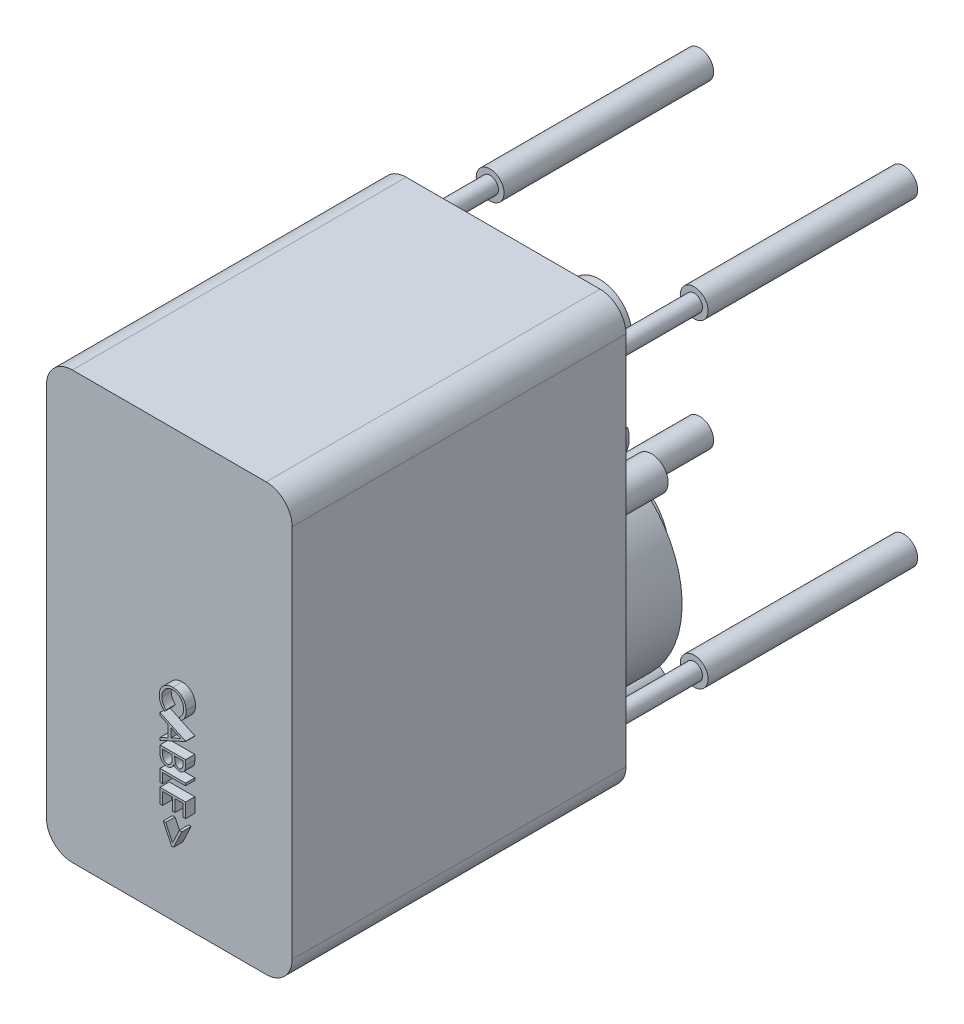
from build123d import *

# Parameters (mm, degrees)
BOSS_EXTRUDE1_DEPTH      = 10.16
SKETCH2_R                = 6.35
BOSS_EXTRUDE2_DEPTH      = 1.778
SKETCH3_R                = 2.286
BOSS_EXTRUDE3_DEPTH      = 1.27
BOSS_EXTRUDE4_DEPTH      = 3.302
BOSS_EXTRUDE5_DEPTH      = 11.43
SKETCH6_R                = 1.143
BOSS_EXTRUDE6_DEPTH      = 15.494
BOSS_EXTRUDE6_2_DEPTH    = 15.494
BOSS_EXTRUDE6_3_DEPTH    = 15.494
BOSS_EXTRUDE6_4_DEPTH    = 15.494
SKETCH7_R                = 7.239
BOSS_EXTRUDE7_DEPTH      = 5.334
BOSS_EXTRUDE8_DEPTH      = 45.72
BOSS_EXTRUDE9_DEPTH      = 25.4
BOSS_EXTRUDE9_DEPTH_BACK = 3.302
SKETCH9_R                = 1.905
BOSS_EXTRUDE10_DEPTH     = 1.27


with BuildPart() as part:
    # Sketch1 → Boss-Extrude1 (new body)
    with BuildSketch(Plane.XY):
        with BuildLine():
            ThreePointArc((10.064128852, -22.930567504), (14.351, -12.7), (10.064128852, -2.469432496))
            ThreePointArc((10.064128852, -2.469432496), (10.236847552, 1.339105214), (6.663505747, 0.010188518))
            ThreePointArc((6.663505747, 0.010188518), (0, 1.651), (-6.663505747, 0.010188518))
            ThreePointArc((-6.663505747, 0.010188518), (-10.236847552, 1.339105214), (-10.064128852, -2.469432496))
            ThreePointArc((-10.064128852, -2.469432496), (-14.351, -12.7), (-10.064128852, -22.930567504))
            ThreePointArc((-10.064128852, -22.930567504), (-10.236847552, -26.739105214), (-6.663505747, -25.410188518))
            ThreePointArc((-6.663505747, -25.410188518), (0, -27.051), (6.663505747, -25.410188518))
            ThreePointArc((6.663505747, -25.410188518), (10.236847552, -26.739105214), (10.064128852, -22.930567504))
        make_face()
    extrude(amount=-BOSS_EXTRUDE1_DEPTH)

    # Sketch3 → Boss-Extrude3 (add)
    with BuildSketch(Plane(origin=(0, 0, -10.16), x_dir=(-1, 0, 0), z_dir=(0, 0, -1))):
        with Locations((-8.89, -0.508)):
            Circle(SKETCH3_R)
        with Locations((8.89, -24.892)):
            Circle(SKETCH3_R)
        with Locations((-8.89, -24.892)):
            Circle(SKETCH3_R)
        with Locations((8.89, -0.508)):
            Circle(SKETCH3_R)
    extrude(amount=BOSS_EXTRUDE3_DEPTH)

    # Sketch4 → Boss-Extrude4 (add)
    with BuildSketch(Plane(origin=(0, 0, -10.16), x_dir=(-1, 0, 0), z_dir=(0, 0, -1))):
        with BuildLine():
            ThreePointArc((-3.62043784, 1.186815), (0, -3.81), (3.62043784, 1.186815))
            ThreePointArc((3.62043784, 1.186815), (0, 1.651), (-3.62043784, 1.186815))
        make_face()
    extrude(amount=BOSS_EXTRUDE4_DEPTH)

    # Sketch7 → Boss-Extrude7 (add)
    with BuildSketch(Plane(origin=(0, 0, -10.16), x_dir=(-1, 0, 0), z_dir=(0, 0, -1))):
        with Locations((0, -12.7)):
            Circle(SKETCH7_R)
    extrude(amount=BOSS_EXTRUDE7_DEPTH)



with BuildPart() as body_2:
    # Sketch2 → Boss-Extrude2 (new body)
    with BuildSketch(Plane.XY):
        with Locations((0, 14.605)):
            Circle(SKETCH2_R)
    extrude(amount=-BOSS_EXTRUDE2_DEPTH)

    # Sketch5 → Boss-Extrude5 (add)
    with BuildSketch(Plane(origin=(0, 0, -1.778), x_dir=(-1, 0, 0), z_dir=(0, 0, -1))):
        with BuildLine():
            ThreePointArc((2e-08, 8.255), (3.14308965, 9.556910365), (4.445, 12.7))
            ThreePointArc((4.445, 12.7), (-3.14308965, 15.843089635), (2e-08, 8.255))
        make_face()
    extrude(amount=BOSS_EXTRUDE5_DEPTH)


with BuildPart() as body_3:
    # Sketch6 → Boss-Extrude6 (new body)
    with BuildSketch(Plane.XY):
        with Locations((13.97, 21.844)):
            Circle(SKETCH6_R)
    extrude(amount=-BOSS_EXTRUDE6_DEPTH)


with BuildPart() as body_4:
    # Sketch6 → Boss-Extrude6 2 (new body)
    with BuildSketch(Plane.XY):
        with Locations((-13.97, 21.844)):
            Circle(SKETCH6_R)
    extrude(amount=-BOSS_EXTRUDE6_2_DEPTH)


with BuildPart() as body_5:
    # Sketch6 → Boss-Extrude6 3 (new body)
    with BuildSketch(Plane.XY):
        with Locations((13.97, -21.844)):
            Circle(SKETCH6_R)
    extrude(amount=-BOSS_EXTRUDE6_3_DEPTH)


with BuildPart() as body_6:
    # Sketch6 → Boss-Extrude6 4 (new body)
    with BuildSketch(Plane.XY):
        with Locations((-13.97, -21.844)):
            Circle(SKETCH6_R)
    extrude(amount=-BOSS_EXTRUDE6_4_DEPTH)


with BuildPart() as part_1:
    add(part.part)

    add(body_2.part)  # Boss-Extrude8 merges body 2

    add(body_3.part)  # Boss-Extrude8 merges body 3

    add(body_4.part)  # Boss-Extrude8 merges body 4

    add(body_5.part)  # Boss-Extrude8 merges body 5

    add(body_6.part)  # Boss-Extrude8 merges body 6
    # Sketch8 → Boss-Extrude8 (add)
    with BuildSketch(Plane.XY):
        with BuildLine():
            Line((-13.2715, 29.21), (13.2715, 29.21))
            ThreePointArc((13.2715, 29.21), (15.785971714, 28.168471714), (16.8275, 25.654))
            Line((16.8275, 25.654), (16.8275, -25.654))
            ThreePointArc((16.8275, -25.654), (15.785971714, -28.168471714), (13.2715, -29.21))
            Line((13.2715, -29.21), (-13.2715, -29.21))
            ThreePointArc((-13.2715, -29.21), (-15.785971714, -28.168471714), (-16.8275, -25.654))
            Line((-16.8275, -25.654), (-16.8275, 25.654))
            ThreePointArc((-16.8275, 25.654), (-15.785971714, 28.168471714), (-13.2715, 29.21))
        make_face()
    extrude(amount=BOSS_EXTRUDE8_DEPTH)

    # Sketch9 → Boss-Extrude9 (add, two sides: drawn at the far end of the back side and taken through both)
    with BuildSketch(Plane(origin=(0, 0, -15.494), x_dir=(-1, 0, 0), z_dir=(0, 0, -1)).offset(-BOSS_EXTRUDE9_DEPTH_BACK)):
        with Locations((-13.97, 21.844)):
            Circle(SKETCH9_R)
        with Locations((13.97, 21.844)):
            Circle(SKETCH9_R)
        with Locations((13.97, -21.844)):
            Circle(SKETCH9_R)
        with Locations((-13.97, -21.844)):
            Circle(SKETCH9_R)
    extrude(amount=BOSS_EXTRUDE9_DEPTH + BOSS_EXTRUDE9_DEPTH_BACK)

    # Sketch10 → Boss-Extrude10 (add)
    # profile 1 of 6: a face of its own
    with BuildSketch(Plane.XY.offset(45.72)):
        with BuildLine():
            Line((2.857772436, -3.679487179), (2.647435897, -3.404647436))
            add(Edge.make_bspline(
                [(2.647435897, -3.404647436), (2.670801867, -3.385041548), (2.717218783, -3.346094101), (2.782398327, -3.283434898), (2.843463589, -3.218133255), (2.900705469, -3.150214134), (2.952122234, -3.078455015), (3.000393337, -3.004594216), (3.043661075, -2.927396171), (3.096124061, -2.820644436), (3.150870216, -2.680996588), (3.196773448, -2.505201749), (3.225994623, -2.32169065), (3.229159465, -2.196493051), (3.230769231, -2.1328125)],
                knots=[0, 0, 0, 0, 0.757959112, 1.505699292, 2.245454638, 2.979532153, 3.711538275, 4.438200793, 5.171680507, 5.909471876, 7.393775596, 8.890124382, 10.418191784, 12, 12, 12, 12], degree=3))
            add(Edge.make_bspline(
                [(3.230769231, -2.1328125), (3.230363445, -2.097729627), (3.229555641, -2.027889483), (3.218973416, -1.924234716), (3.20392868, -1.822319184), (3.1821483, -1.722521872), (3.153792222, -1.625040935), (3.120538112, -1.529134135), (3.079156746, -1.435930999), (3.033456552, -1.34430985), (2.981823731, -1.256534692), (2.925523467, -1.173466714), (2.865108338, -1.095485416), (2.800734294, -1.02237471), (2.731601295, -0.954936411), (2.658522608, -0.892089722), (2.580618642, -0.834967287), (2.499350418, -0.782165421), (2.41459849, -0.735181205), (2.326896016, -0.694608059), (2.236578315, -0.6598335), (2.143460367, -0.632062149), (2.047908611, -0.610157149), (1.949720267, -0.59502418), (1.849085923, -0.584537152), (1.780876701, -0.583736779), (1.746494391, -0.583333333)],
                knots=[0, 0, 0, 0, 1.055000685, 2.100209969, 3.131349012, 4.153242145, 5.170189196, 6.184191144, 7.204341339, 8.235672124, 9.263040994, 10.265373269, 11.252624173, 12.22887325, 13.193405896, 14.155809299, 15.126090485, 16.097288279, 17.069732292, 18.038585918, 19.002221264, 19.978698174, 20.959418239, 21.948869816, 22.966084182, 24, 24, 24, 24], degree=3))
            add(Edge.make_bspline(
                [(1.746494391, -0.583333333), (1.694763071, -0.584595152), (1.593195486, -0.587072567), (1.444424876, -0.609120901), (1.301904202, -0.642625992), (1.16652436, -0.692841569), (1.036616002, -0.75476062), (0.914377148, -0.833001231), (0.797960584, -0.923617768), (0.690117636, -1.027892188), (0.591603911, -1.142298004), (0.504853329, -1.265045915), (0.432538447, -1.395830203), (0.3723625, -1.533206833), (0.326105772, -1.678232947), (0.293541649, -1.83064775), (0.272299468, -1.990119745), (0.27026578, -2.099089145), (0.269230769, -2.154547276)],
                knots=[0, 0, 0, 0, 1.029171465, 2.020641659, 2.987623507, 3.938342917, 4.889210282, 5.84687017, 6.821220943, 7.821438502, 8.827599549, 9.822697543, 10.807740252, 11.797342354, 12.80366471, 13.83203677, 14.896651826, 16, 16, 16, 16], degree=3))
            add(Edge.make_bspline(
                [(0.269230769, -2.154547276), (0.270919549, -2.215649965), (0.274243472, -2.335914674), (0.302402721, -2.5122827), (0.348060638, -2.681118466), (0.411958561, -2.842431052), (0.495023849, -2.995765698), (0.595721726, -3.141362359), (0.715010059, -3.279343929), (0.806093187, -3.362315211), (0.852564103, -3.404647436)],
                knots=[0, 0, 0, 0, 1.028121516, 2.023589091, 2.998037872, 3.967518031, 4.937445131, 5.927275754, 6.942489185, 8, 8, 8, 8], degree=3))
            Line((0.852564103, -3.404647436), (0.644330929, -3.679487179))
            add(Edge.make_bspline(
                [(0.644330929, -3.679487179), (0.615792429, -3.657369099), (0.558852125, -3.613238882), (0.478581139, -3.54178043), (0.403074401, -3.466504759), (0.332956835, -3.386842997), (0.266764666, -3.303747898), (0.206716932, -3.215755784), (0.150984484, -3.12438645), (0.100628049, -3.02910793), (0.05547798, -2.930233036), (0.017361042, -2.827864665), (-0.015946051, -2.722870088), (-0.04316627, -2.615196429), (-0.064445988, -2.50448398), (-0.078663293, -2.391112597), (-0.088405847, -2.274842967), (-0.089293675, -2.196401513), (-0.08974359, -2.156650641)],
                knots=[0, 0, 0, 0, 0.986756325, 1.968786143, 2.935506311, 3.899499537, 4.868307269, 5.8376204, 6.809456583, 7.792545619, 8.781780509, 9.778496008, 10.776623214, 11.79151764, 12.812666265, 13.856269958, 14.913646641, 16, 16, 16, 16], degree=3))
            add(Edge.make_bspline(
                [(-0.08974359, -2.156650641), (-0.089481597, -2.119006974), (-0.088963539, -2.044571284), (-0.080571372, -1.934672532), (-0.069121635, -1.827682951), (-0.051881504, -1.723908326), (-0.031537164, -1.622782351), (-0.004265907, -1.525221766), (0.026283259, -1.430266556), (0.062188246, -1.338298215), (0.102704429, -1.249238515), (0.148495987, -1.163374704), (0.199177852, -1.080746271), (0.253632863, -1.000540851), (0.313610164, -0.923943267), (0.378276799, -0.850289742), (0.44741481, -0.779167265), (0.497269663, -0.73516458), (0.522335737, -0.713040865)],
                knots=[0, 0, 0, 0, 1.114604814, 2.203992996, 3.262667896, 4.300477797, 5.318619304, 6.316056647, 7.298880507, 8.271930387, 9.238335007, 10.195173496, 11.151986948, 12.108099108, 13.064862484, 14.031167946, 15.010108607, 16, 16, 16, 16], degree=3))
            add(Edge.make_bspline(
                [(0.522335737, -0.713040865), (0.565876926, -0.677605222), (0.652433637, -0.607161745), (0.792719618, -0.517036062), (0.939187827, -0.439888506), (1.092607755, -0.377512586), (1.252635143, -0.328749852), (1.419350657, -0.294968657), (1.592598599, -0.273017053), (1.710435388, -0.270506764), (1.770332532, -0.269230769)],
                knots=[0, 0, 0, 0, 0.994628077, 1.977248131, 2.950237994, 3.925870899, 4.908910175, 5.911660606, 6.938484602, 8, 8, 8, 8], degree=3))
            add(Edge.make_bspline(
                [(1.770332532, -0.269230769), (1.833285352, -0.270792919), (1.957141094, -0.27386635), (2.138952641, -0.299762866), (2.312890308, -0.341927395), (2.479623367, -0.399988234), (2.638197835, -0.476586004), (2.789283438, -0.569313798), (2.93275681, -0.679077345), (3.066783632, -0.804498118), (3.18931972, -0.9420727), (3.297126777, -1.089389619), (3.386844068, -1.246172066), (3.461840291, -1.410689784), (3.519484737, -1.584175502), (3.559837929, -1.766258861), (3.584955044, -1.956597778), (3.588130252, -2.086460203), (3.58974359, -2.15244391)],
                knots=[0, 0, 0, 0, 1.032901378, 2.032168977, 3.007206631, 3.966850309, 4.924221947, 5.891988639, 6.871730993, 7.884084801, 8.900290346, 9.89161143, 10.874607481, 11.860025555, 12.854717796, 13.869097222, 14.917278314, 16, 16, 16, 16], degree=3))
            add(Edge.make_bspline(
                [(3.58974359, -2.15244391), (3.589261812, -2.192658461), (3.588308181, -2.272259114), (3.578996816, -2.390010625), (3.563502411, -2.50465715), (3.542274027, -2.616475949), (3.516255146, -2.725872498), (3.482194419, -2.83172447), (3.442641565, -2.934608269), (3.39824916, -3.03460095), (3.347498469, -3.130614623), (3.292377899, -3.222631813), (3.231615083, -3.309542503), (3.167218841, -3.392981488), (3.096780331, -3.471070292), (3.022593437, -3.546039113), (2.942456775, -3.615298244), (2.886052222, -3.658051701), (2.857772436, -3.679487179)],
                knots=[0, 0, 0, 0, 1.096705196, 2.170817488, 3.219277236, 4.250701065, 5.274195539, 6.284202015, 7.28098643, 8.279664616, 9.266225751, 10.241373748, 11.203306326, 12.157093976, 13.114198862, 14.069774147, 15.032234603, 16, 16, 16, 16], degree=3))
        make_face()
    # profile 2 of 6: a face of its own
    with BuildSketch(Plane.XY.offset(45.72)):
        Polygon((3.5, -5.833333333), (0, -7.448717949), (0, -7.107271635), (1.121794872, -6.58984375), (1.121794872, -5.003205128), (0, -4.471053686), (0, -4.128205128), (3.5, -5.788461538), align=None)
        Polygon((2.817808494, -5.807391827), (1.480769231, -5.173577724), (1.480769231, -6.424379006), align=None, mode=Mode.SUBTRACT)
    # profile 3 of 6: a face of its own
    with BuildSketch(Plane.XY.offset(45.72)):
        with BuildLine():
            Line((3.5, -7.987179487), (3.5, -8.670072115))
            add(Edge.make_bspline(
                [(3.5, -8.670072115), (3.49982425, -8.703500594), (3.499483602, -8.768293304), (3.49420047, -8.862512746), (3.486996801, -8.950761556), (3.475566708, -9.033065329), (3.461774931, -9.109386031), (3.445073115, -9.179953668), (3.425046501, -9.244543841), (3.39320022, -9.321656577), (3.345877051, -9.409577238), (3.275948486, -9.504775631), (3.190416023, -9.58617987), (3.093933368, -9.656366187), (2.987797596, -9.712167307), (2.874538407, -9.752536604), (2.755616665, -9.778094479), (2.673973487, -9.780722914), (2.63271234, -9.782051282)],
                knots=[0, 0, 0, 0, 1.001505555, 1.941167018, 2.826882275, 3.653841531, 4.429895133, 5.150066043, 5.825578002, 6.45369114, 7.647487171, 8.808567382, 9.977351308, 11.170798116, 12.373658725, 13.556498008, 14.765093433, 16, 16, 16, 16], degree=3))
            add(Edge.make_bspline(
                [(2.63271234, -9.782051282), (2.594053235, -9.780979192), (2.518084448, -9.778872435), (2.407150679, -9.758040783), (2.301116128, -9.727025424), (2.201287981, -9.682000287), (2.108949247, -9.624084028), (2.02464869, -9.554388494), (1.950429264, -9.471406851), (1.909109541, -9.409135189), (1.888120994, -9.377504006)],
                knots=[0, 0, 0, 0, 1.044266239, 2.052081639, 3.041743201, 4.026043445, 5.00270663, 5.980942822, 6.97441044, 8, 8, 8, 8], degree=3))
            add(Edge.make_bspline(
                [(1.888120994, -9.377504006), (1.872867775, -9.417271093), (1.843684588, -9.49335538), (1.791808319, -9.598132695), (1.736021049, -9.688767398), (1.674776106, -9.76535925), (1.607935032, -9.829876034), (1.536836284, -9.887813444), (1.45797957, -9.936352004), (1.37361028, -9.978050718), (1.284320561, -10.010867169), (1.190518767, -10.034086961), (1.093253774, -10.048354394), (1.026957798, -10.050299901), (0.993489583, -10.051282051)],
                knots=[0, 0, 0, 0, 1.272302504, 2.434229863, 3.488457646, 4.447234501, 5.35599188, 6.26022912, 7.18267843, 8.11661068, 9.06895546, 10.019249207, 11.000057067, 12, 12, 12, 12], degree=3))
            add(Edge.make_bspline(
                [(0.993489583, -10.051282051), (0.959322905, -10.050304899), (0.892099008, -10.048382324), (0.793341106, -10.034206731), (0.698976329, -10.010181531), (0.60833373, -9.977169594), (0.521926377, -9.933840061), (0.438672091, -9.882245878), (0.36078871, -9.819449219), (0.286424081, -9.749453453), (0.219600708, -9.670175718), (0.160109352, -9.584653658), (0.110959363, -9.491657184), (0.070188246, -9.392628424), (0.038590839, -9.286909331), (0.016654453, -9.174891884), (0.001839273, -9.056551741), (0.000623494, -8.975341406), (0, -8.93369391)],
                knots=[0, 0, 0, 0, 0.978404568, 1.925038397, 2.85041836, 3.763147166, 4.682162379, 5.614488577, 6.562659439, 7.54271123, 8.535210642, 9.526693784, 10.520907202, 11.541451354, 12.589717429, 13.675358278, 14.807842563, 16, 16, 16, 16], degree=3))
            Line((0, -8.93369391), (0, -7.987179487))
            Line((0, -7.987179487), (3.5, -7.987179487))
        make_face()
        with BuildLine():
            Line((3.141025641, -8.301282051), (2.019230769, -8.301282051))
            Line((2.019230769, -8.301282051), (2.019230769, -8.512319712))
            add(Edge.make_bspline(
                [(2.019230769, -8.512319712), (2.019627364, -8.543168785), (2.020393667, -8.602775481), (2.022657945, -8.689324772), (2.028720383, -8.769462091), (2.035132411, -8.843463576), (2.045005621, -8.910833237), (2.057087658, -8.97179661), (2.069753809, -9.026901337), (2.091355012, -9.090420305), (2.122955643, -9.162449973), (2.173150423, -9.238748286), (2.231312009, -9.307103551), (2.299660574, -9.364179334), (2.374282065, -9.411276833), (2.455183134, -9.44270766), (2.539205431, -9.465001132), (2.597038901, -9.466956125), (2.626402244, -9.467948718)],
                knots=[0, 0, 0, 0, 1.156481963, 2.23455883, 3.244418989, 4.168404366, 5.01828131, 5.794834307, 6.498111525, 7.13526334, 8.307595709, 9.435046769, 10.546766856, 11.659452936, 12.760769924, 13.837671619, 14.902137667, 16, 16, 16, 16], degree=3))
            add(Edge.make_bspline(
                [(2.626402244, -9.467948718), (2.645837164, -9.46745228), (2.683960884, -9.466478463), (2.739322416, -9.457615573), (2.792056229, -9.444755433), (2.84094948, -9.424663971), (2.887391857, -9.40036924), (2.929320542, -9.368766205), (2.969032638, -9.333075662), (3.005070015, -9.291160594), (3.037359647, -9.243223955), (3.06577169, -9.188808998), (3.088183923, -9.12726598), (3.108288888, -9.059990319), (3.122239543, -8.985905328), (3.133904149, -8.905734918), (3.13983359, -8.81879898), (3.140619428, -8.758654053), (3.141025641, -8.727564103)],
                knots=[0, 0, 0, 0, 0.911752476, 1.788502045, 2.626783689, 3.45400582, 4.26402138, 5.080402872, 5.911472738, 6.767166405, 7.66795952, 8.620018292, 9.640966946, 10.73819047, 11.913090943, 13.176185384, 14.540321519, 16, 16, 16, 16], degree=3))
            Line((3.141025641, -8.727564103), (3.141025641, -8.301282051))
        make_face(mode=Mode.SUBTRACT)
        with BuildLine():
            Line((1.66025641, -8.301282051), (0.358974359, -8.301282051))
            Line((0.358974359, -8.301282051), (0.358974359, -8.748597756))
            add(Edge.make_bspline(
                [(0.358974359, -8.748597756), (0.359356766, -8.780616841), (0.360093805, -8.842329406), (0.362526199, -8.931428523), (0.367942779, -9.013786891), (0.376773248, -9.089451901), (0.385948875, -9.159089613), (0.398648387, -9.222008173), (0.413086196, -9.278304041), (0.43542939, -9.343572232), (0.470080688, -9.417115598), (0.522667742, -9.496314398), (0.584492161, -9.56743167), (0.656948104, -9.627131057), (0.735135085, -9.676428471), (0.81864416, -9.711003623), (0.904927716, -9.733234951), (0.963909533, -9.735861995), (0.993489583, -9.737179487)],
                knots=[0, 0, 0, 0, 1.159821618, 2.235403267, 3.228114831, 4.14795534, 4.994323282, 5.771256229, 6.471395042, 7.097801288, 8.267864287, 9.404187171, 10.531774336, 11.667624178, 12.792825787, 13.866573821, 14.930062559, 16, 16, 16, 16], degree=3))
            add(Edge.make_bspline(
                [(0.993489583, -9.737179487), (1.011985316, -9.736910196), (1.048678445, -9.736375957), (1.102559382, -9.728016016), (1.154984973, -9.716353352), (1.205162465, -9.699464814), (1.253908353, -9.678169735), (1.30037356, -9.651445218), (1.345669087, -9.620583465), (1.402867072, -9.572305486), (1.468791298, -9.502150596), (1.533326389, -9.402438104), (1.585374877, -9.28906742), (1.607474256, -9.206839697), (1.618890224, -9.164362981)],
                knots=[0, 0, 0, 0, 0.723503378, 1.435336582, 2.130201219, 2.824764462, 3.504949994, 4.209866579, 4.920640069, 5.648298893, 7.13757748, 8.670694625, 10.280166878, 12, 12, 12, 12], degree=3))
            add(Edge.make_bspline(
                [(1.618890224, -9.164362981), (1.622345541, -9.147333901), (1.629837379, -9.110411343), (1.637740616, -9.050203457), (1.644830077, -8.981237103), (1.64993647, -8.903807058), (1.655418093, -8.81760537), (1.657474037, -8.722659733), (1.659983424, -8.618903025), (1.660163087, -8.546910565), (1.66025641, -8.509515224)],
                knots=[0, 0, 0, 0, 0.634452549, 1.375623993, 2.216454381, 3.166361212, 4.209414599, 5.370755378, 6.634280627, 8, 8, 8, 8], degree=3))
            Line((1.66025641, -8.509515224), (1.66025641, -8.301282051))
        make_face(mode=Mode.SUBTRACT)
    # profile 4 of 6: a face of its own
    with BuildSketch(Plane.XY.offset(45.72)):
        Polygon((3.5, -10.769230769), (3.5, -11.083333333), (0.358974359, -11.083333333), (0.358974359, -12.429487179), (0, -12.429487179), (0, -10.769230769), align=None)
    # profile 5 of 6: a face of its own
    with BuildSketch(Plane.XY.offset(45.72)):
        Polygon((3.5, -13.012820513), (3.5, -14.987179487), (3.141025641, -14.987179487), (3.141025641, -13.326923077), (2.064102564, -13.326923077), (2.064102564, -14.987179487), (1.705128205, -14.987179487), (1.705128205, -13.326923077), (0.358974359, -13.326923077), (0.358974359, -14.987179487), (0, -14.987179487), (0, -13.012820513), align=None)
    # profile 6 of 6: a face of its own
    with BuildSketch(Plane.XY.offset(45.72)):
        Polygon((0.790164263, -16.782051282), (1.727564103, -18.746594551), (2.664963942, -16.782051282), (3.006410256, -16.782051282), (1.850260417, -19.205128205), (1.604867788, -19.205128205), (0.448717949, -16.782051282), align=None)
    extrude(amount=BOSS_EXTRUDE10_DEPTH)


solid = part_1.part
